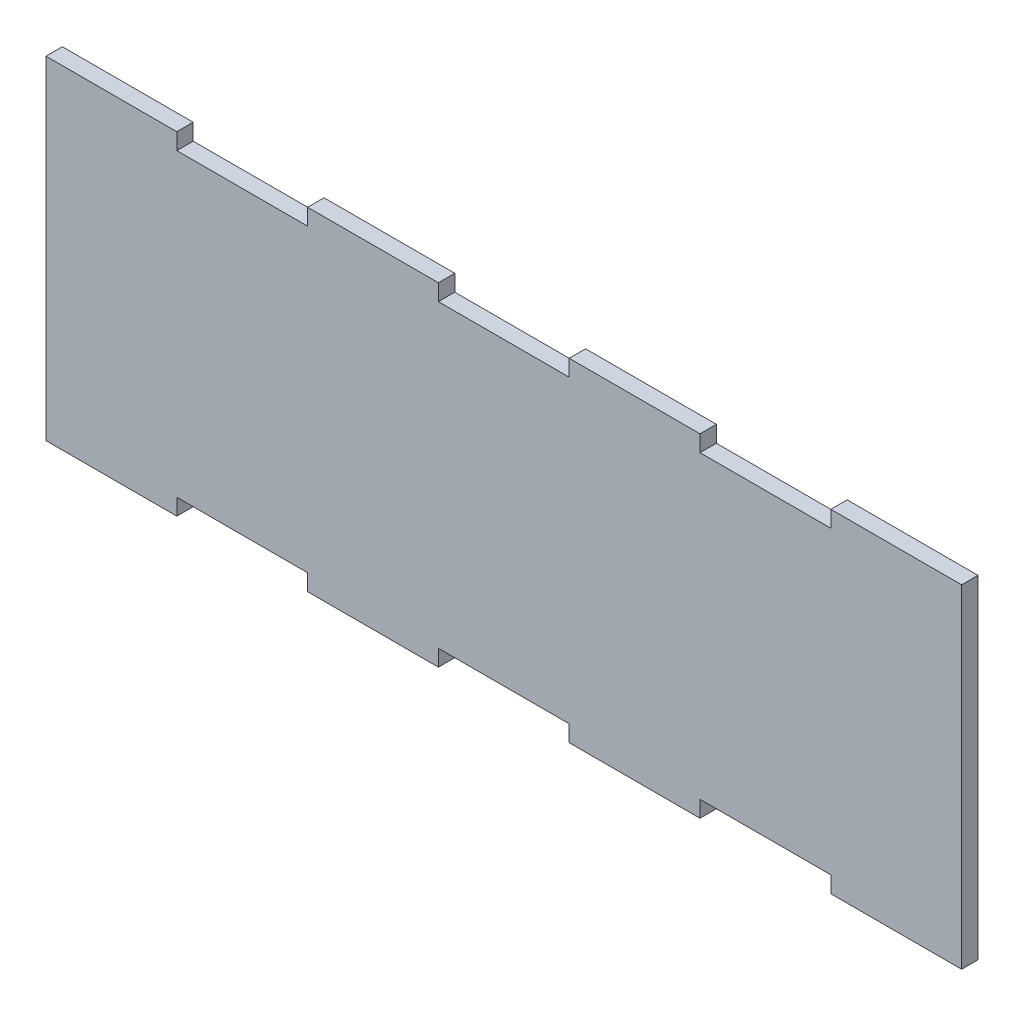
from build123d import *

# Parameters (mm, degrees)
SKETCH1_W           = 139.7
SKETCH1_H           = 50.8
BOSS_EXTRUDE1_DEPTH = 2.5
SKETCH3_W           = 19.957142857
SKETCH3_H           = 2.5
SKETCH3_W_2         = 19.957142858
CUT_EXTRUDE2_DEPTH  = 2.54


with BuildPart() as part:
    # Sketch1 → Boss-Extrude1 (new body)
    with BuildSketch(Plane.XY):
        Rectangle(SKETCH1_W, SKETCH1_H)
    extrude(amount=BOSS_EXTRUDE1_DEPTH)

    # Sketch3 → Cut-Extrude2 (cut)
    with BuildSketch(Plane(origin=(0, 0, 0), x_dir=(-1, 0, 0), z_dir=(0, 0, -1))):
        with Locations((-39.914285715, 24.15)):
            Rectangle(SKETCH3_W, SKETCH3_H)
        with Locations((0, 24.15)):
            Rectangle(SKETCH3_W_2, SKETCH3_H)
        with Locations((39.914285715, 24.15)):
            Rectangle(SKETCH3_W, SKETCH3_H)
        with Locations((-39.914285715, -24.15)):
            Rectangle(SKETCH3_W, SKETCH3_H)
        with Locations((0, -24.15)):
            Rectangle(SKETCH3_W_2, SKETCH3_H)
        with Locations((39.914285715, -24.15)):
            Rectangle(SKETCH3_W, SKETCH3_H)
    extrude(amount=-CUT_EXTRUDE2_DEPTH, mode=Mode.SUBTRACT)


solid = part.part
